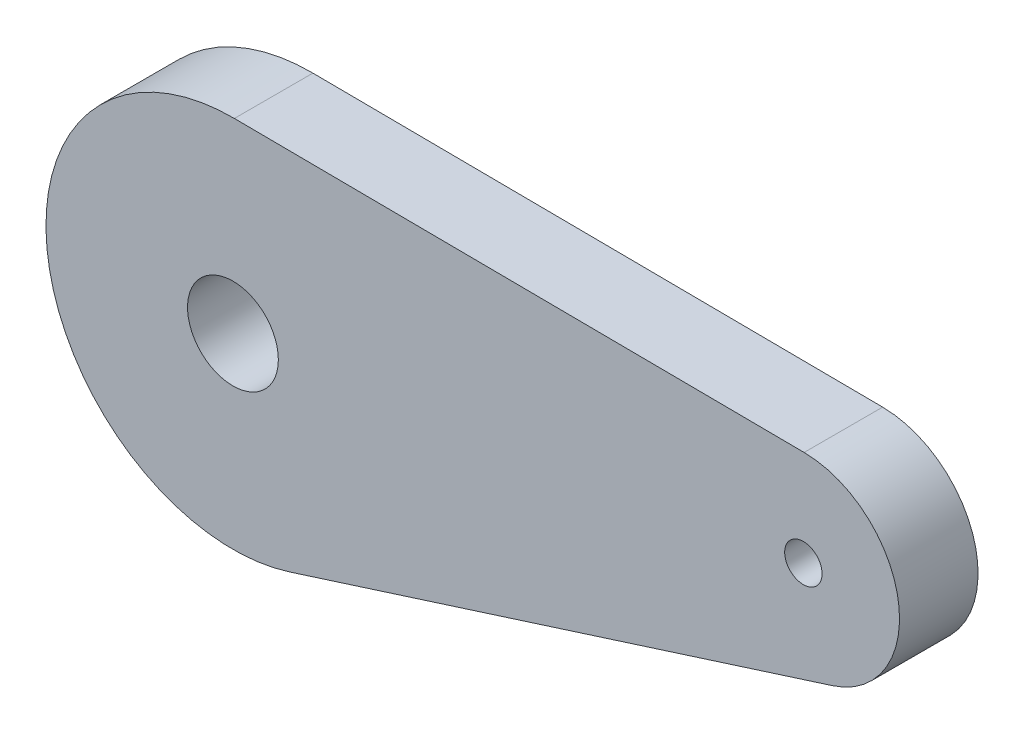
from build123d import *

# Parameters (mm, degrees)
SKETCH3_R           = 4.25
SKETCH3_R_2         = 1.75
BOSS_EXTRUDE4_DEPTH = 3.675


with BuildPart() as part:
    # Sketch3 → Boss-Extrude4 (new, symmetric)
    with BuildSketch(Plane.XY):
        with BuildLine():
            ThreePointArc((-20.085093872, 75.379480002), (-37.522562339, 55.258676576), (-14.907803169, 41.205751446))
            Line((-14.907803169, 41.205751446), (35.902750732, 57.393327309))
            ThreePointArc((35.902750732, 57.393327309), (42.069224422, 67.316764326), (33.240144084, 74.968387709))
            Line((33.240144084, 74.968387709), (-20.085093872, 75.379480002))
        make_face()
        with Locations((-20.22, 57.88)):
            Circle(SKETCH3_R, mode=Mode.SUBTRACT)
        with Locations((33.17076379, 65.968655136)):
            Circle(SKETCH3_R_2, mode=Mode.SUBTRACT)
    extrude(amount=BOSS_EXTRUDE4_DEPTH, both=True)


solid = part.part
